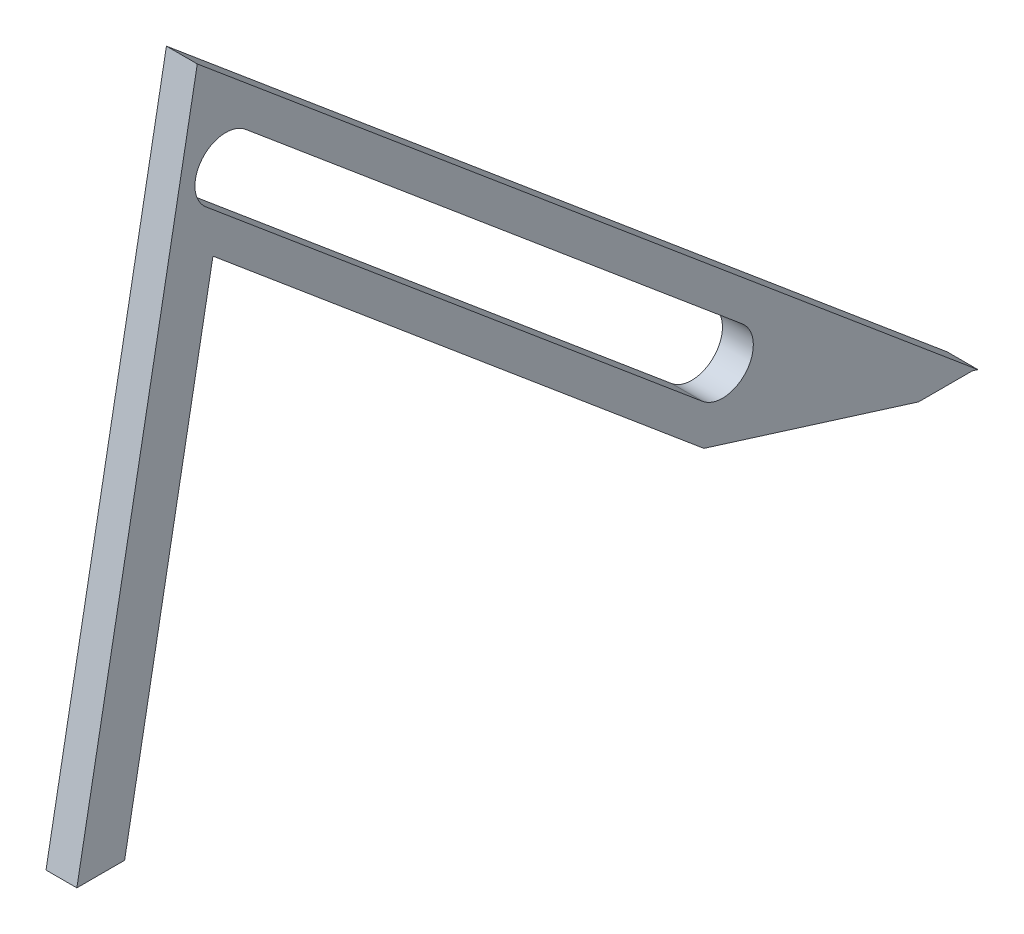
from build123d import *

# Parameters (mm, degrees)
BOSS_EXTRUDE1_DEPTH = 12.7


with BuildPart() as part:
    # Sketch1 → Boss-Extrude1 (new body)
    with BuildSketch(Plane(origin=(0, 0, 0), x_dir=(0, 0, -1), z_dir=(1, 0, 0))):
        Polygon((-394.946506416, 268.859), (-444.5, 0), (-424.843977237, 0), (-388.508616862, 197.142278951), (-266.964417858, 95.154586396), (-186.461552382, 27.604661666), (-98.092418556, 0), (-75.979077973, 0), (-73.675108156, -0.719711788), align=None)
        with BuildLine():
            Line((-375.052513862, 235.58728561), (-170.667115901, 64.087573564))
            ThreePointArc((-170.667115901, 64.087573564), (-169.101754117, 46.195406493), (-186.993921187, 44.630044709))
            Line((-186.993921187, 44.630044709), (-391.379319148, 216.129756755))
            ThreePointArc((-391.379319148, 216.129756755), (-392.944680933, 234.021923826), (-375.052513862, 235.58728561))
        make_face(mode=Mode.SUBTRACT)
    extrude(amount=BOSS_EXTRUDE1_DEPTH)


solid = part.part
